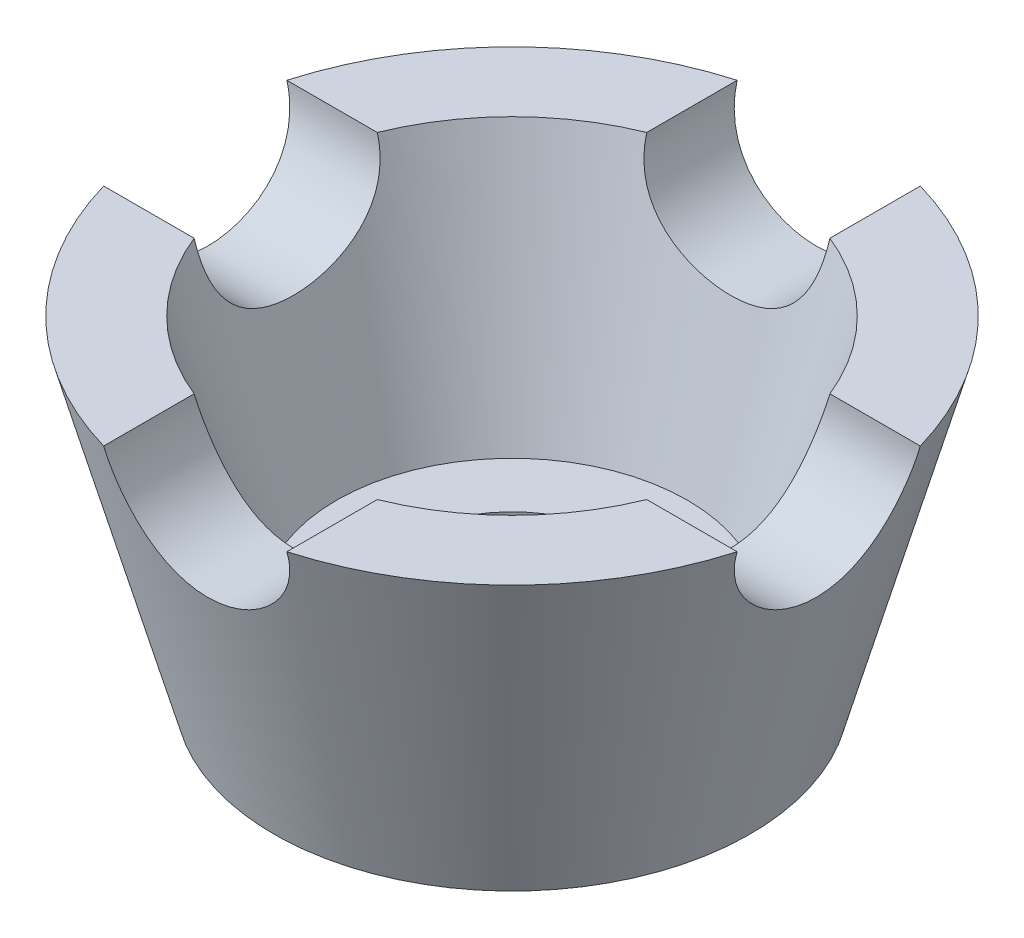
from build123d import *

# Parameters (mm, degrees)
CUT_EXTRUDE1_DEPTH      = 63.353829072
CIRPATTERN1_COUNT       = 4
CUT_EXTRUDE2_DEPTH      = 61.728905976
CUT_EXTRUDE2_DEPTH_BACK = 61.728905976
SKETCH4_R               = 12


with BuildPart() as part:
    # Sketch1 → Revolve1 (revolve)
    with BuildSketch(Plane.XY, mode=Mode.PRIVATE) as revolve1_sk:
        Polygon((0, 9), (0, 0), (26, 0), (36, 36), (26.659229154, 36), (19.159229154, 9), align=None)
    revolve(revolve1_sk.sketch.rotate(Axis((0, 0, 0), (0, 1, 0)), 90), axis=Axis((0, 0, 0), (0, 1, 0)))

    # Sketch2 → Cut-Extrude1 (cut, symmetric)
    with BuildSketch(Plane(origin=(0, 0, 0), x_dir=(0, 0, -1), z_dir=(1, 0, 0))):
        with BuildLine():
            Line((-10, 36), (10, 36))
            ThreePointArc((10, 36), (0, 26), (-10, 36))
        make_face()
    cut_extrude1 = extrude(amount=CUT_EXTRUDE1_DEPTH, both=True, mode=Mode.SUBTRACT)

    # CirPattern1: Cut-Extrude1 ×4 about axis
    cirpattern1_axis = Axis((0, 0, 0), (0, -1, 0))
    for i in range(1, CIRPATTERN1_COUNT):
        add(cut_extrude1.rotate(cirpattern1_axis, i * 360 / CIRPATTERN1_COUNT), mode=Mode.SUBTRACT)

    # Sketch4 → Cut-Extrude2 (cut, two sides: drawn at the far end of the back side and taken through both)
    with BuildSketch(Plane.XZ.offset(-CUT_EXTRUDE2_DEPTH_BACK)):
        with Locations(Location((0, 0, 0), (0, 0, 270))):
            Circle(SKETCH4_R)
    extrude(amount=CUT_EXTRUDE2_DEPTH + CUT_EXTRUDE2_DEPTH_BACK, mode=Mode.SUBTRACT)


solid = part.part
